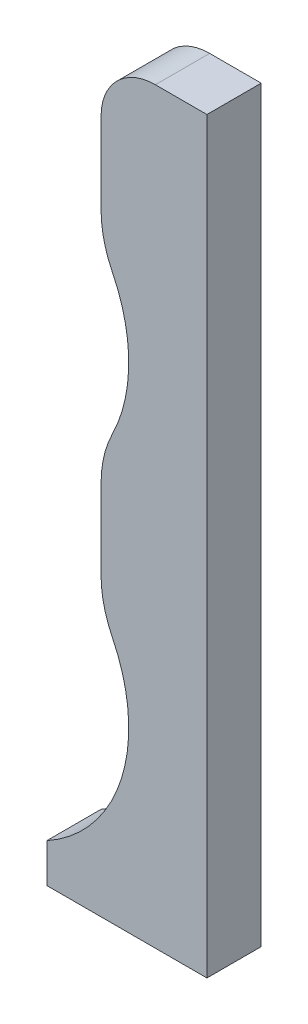
from build123d import *

# Parameters (mm, degrees)
BOSS_EXTRUDE1_DEPTH = 3.175


with BuildPart() as part:
    # Sketch1 → Boss-Extrude1 (new body)
    with BuildSketch(Plane.XY):
        with BuildLine():
            Line((3237.727761218, 2688.297020075), (3237.727761218, 2644.567763294))
            Line((3237.727761218, 2644.567763294), (3228.363010537, 2644.567763294))
            Line((3228.363010537, 2644.567763294), (3228.363010537, 2646.841186109))
            ThreePointArc((3228.363010537, 2646.841186109), (3232.730874641, 2652.176053388), (3232.196435723, 2659.050165748))
            ThreePointArc((3232.196435723, 2659.050165748), (3231.704807481, 2660.420064597), (3231.538010537, 2661.865920732))
            Line((3231.538010537, 2661.865920732), (3231.538010537, 2666.53320074))
            ThreePointArc((3231.538010537, 2666.53320074), (3231.704807481, 2667.979056876), (3232.196435723, 2669.348955725))
            ThreePointArc((3232.196435723, 2669.348955725), (3233.155761218, 2673.451510736), (3232.196435723, 2677.554065748))
            ThreePointArc((3232.196435723, 2677.554065748), (3231.704807481, 2678.923964597), (3231.538010537, 2680.369820732))
            Line((3231.538010537, 2680.369820732), (3231.538010537, 2685.122020075))
            ThreePointArc((3231.538010537, 2685.122020075), (3232.467946507, 2687.367084106), (3234.713010537, 2688.297020075))
            Line((3234.713010537, 2688.297020075), (3237.727761218, 2688.297020075))
        make_face()
    extrude(amount=BOSS_EXTRUDE1_DEPTH)


solid = part.part
